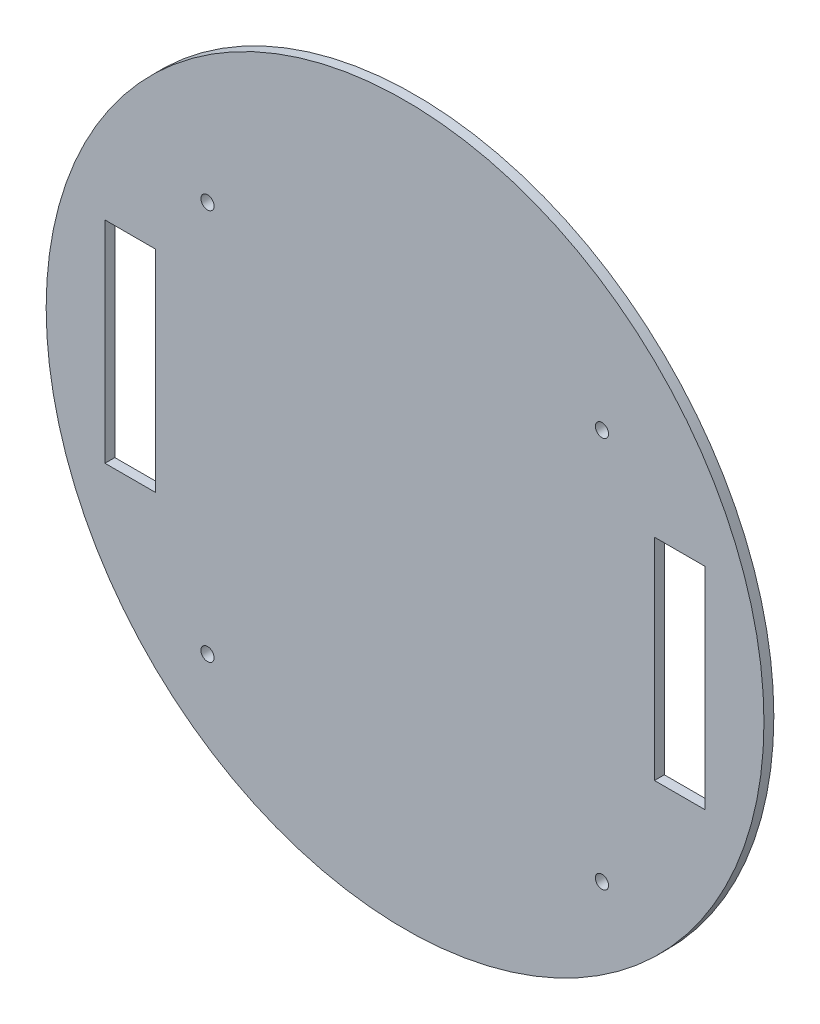
from build123d import *

# Parameters (mm, degrees)
SKETCH1_R                = 54.5
BOSS_EXTRUDE1_DEPTH      = 1.5
SKETCH2_R                = 1
CUT_EXTRUDE1_DEPTH       = 1.58
SKICA1_W                 = 7.7
SKICA1_H                 = 32
ODEBRAT_VYSUNUT_M1_DEPTH = 1.5


with BuildPart() as part:
    # Sketch1 → Boss-Extrude1 (new body)
    with BuildSketch(Plane.XY):
        Circle(SKETCH1_R)
    extrude(amount=BOSS_EXTRUDE1_DEPTH)

    # Sketch2 → Cut-Extrude1 (cut)
    with BuildSketch(Plane.XY.offset(1.5)):
        with Locations((29.900398584, 26.1)):
            Circle(SKETCH2_R)
        with Locations((29.900398584, -33.3)):
            Circle(SKETCH2_R)
        with Locations((-29.999601416, -33.3)):
            Circle(SKETCH2_R)
        with Locations((-29.999601416, 26.1)):
            Circle(SKETCH2_R)
    extrude(amount=-CUT_EXTRUDE1_DEPTH, mode=Mode.SUBTRACT)

    # Skica1 → Odebrat vysunutím1 (cut)
    with BuildSketch(Plane.XY.offset(1.5)):
        with Locations((41.7205, 0)):
            Rectangle(SKICA1_W, SKICA1_H)
        with Locations((-41.7205, 0)):
            Rectangle(SKICA1_W, SKICA1_H)
    extrude(amount=-ODEBRAT_VYSUNUT_M1_DEPTH, mode=Mode.SUBTRACT)


solid = part.part
